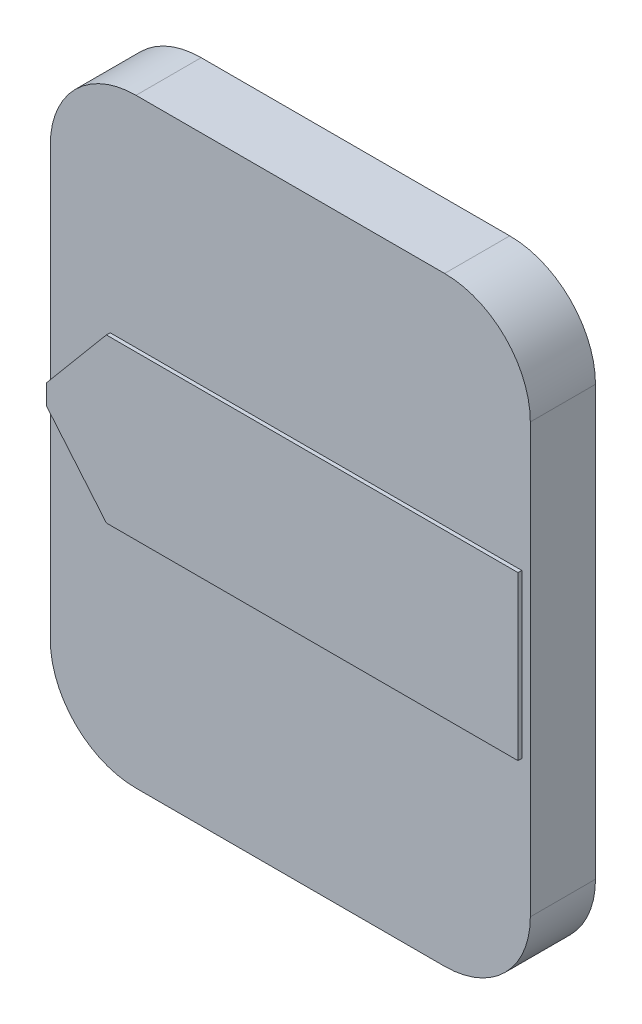
from build123d import *

# Parameters (mm, degrees)
SKETCH1_W           = 2.8
SKETCH1_H           = 3.500049162
BOSS_EXTRUDE1_DEPTH = 0.38
FILLET1_R           = 0.5
BOSS_EXTRUDE2_DEPTH = 0.022
BOSS_EXTRUDE3_DEPTH = 0.022


with BuildPart() as part:
    # Sketch1 → Boss-Extrude1 (new body)
    with BuildSketch(Plane.XY):
        with Locations((1.4, 1.750024557)):
            Rectangle(SKETCH1_W, SKETCH1_H)
    extrude(amount=-BOSS_EXTRUDE1_DEPTH)

    # Fillet1
    fillet1_edges = [part.edges().sort_by_distance(p)[0] for p in [
        (2.8, -2.4e-08, -0.19),
        (0, -2.4e-08, -0.19),
        (0, 3.500049138, -0.19),
        (2.8, 3.500049138, -0.19),
    ]]
    fillet(fillet1_edges, radius=FILLET1_R)

    # Sketch2 → Boss-Extrude2 (add)
    with BuildSketch(Plane.XY):
        Polygon((0, 1.691100092), (0, 1.808949022), (0.3492, 2.225024557), (2.75, 2.225024557), (2.75, 1.275024557), (0.3492, 1.275024557), align=None)
    extrude(amount=BOSS_EXTRUDE2_DEPTH)

    # Sketch3 → Boss-Extrude3 (add)
    with BuildSketch(Plane(origin=(0, 0, -0.38), x_dir=(-1, 0, 0), z_dir=(0, 0, -1))):
        with BuildLine():
            Line((-2.7, 3.000049138), (-2.7, 0.499999976))
            ThreePointArc((-2.7, 0.499999976), (-2.582842712, 0.217157263), (-2.3, 0.099999976))
            Line((-2.3, 0.099999976), (-0.5, 0.099999976))
            ThreePointArc((-0.5, 0.099999976), (-0.217157288, 0.217157263), (-0.1, 0.499999976))
            Line((-0.1, 0.499999976), (-0.1, 3.000049138))
            ThreePointArc((-0.1, 3.000049138), (-0.217157288, 3.282891851), (-0.5, 3.400049138))
            Line((-0.5, 3.400049138), (-2.3, 3.400049138))
            ThreePointArc((-2.3, 3.400049138), (-2.582842712, 3.282891851), (-2.7, 3.000049138))
        make_face()
    extrude(amount=BOSS_EXTRUDE3_DEPTH)


solid = part.part
